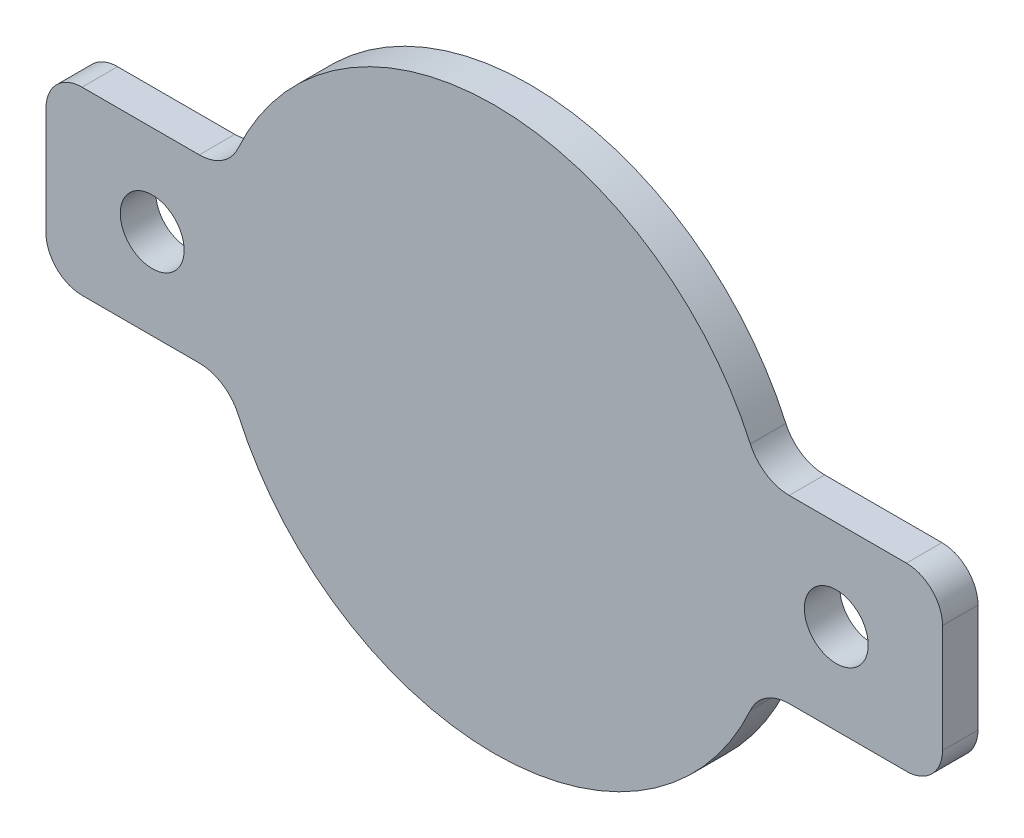
from build123d import *

# Parameters (mm, degrees)
BOSS_EXTRUDE1_DEPTH   = 2.5
FILLET1_R             = 2.54
M4_CLEARANCE_HOLE1_D  = 4.5
BOSS_EXTRUDE2_DEPTH   = 2.5
BOSS_EXTRUDE2_2_DEPTH = 2.5
FILLET2_R             = 3


with BuildPart() as part:
    # Sketch1 → Boss-Extrude1 (new body)
    with BuildSketch(Plane(origin=(0, 0, 0), x_dir=(-1, 0, 0), z_dir=(0, 0, 1))):
        with BuildLine():
            ThreePointArc((17.121950758, 4.160440607), (0.514545783, 15.590440607), (-16.092859192, 4.160440607))
            Line((-16.092859192, 4.160440607), (-31.053947254, 4.160440607))
            Line((-31.053947254, 4.160440607), (-31.053947254, -8.539559393))
            Line((-31.053947254, -8.539559393), (-16.092859192, -8.539559393))
            ThreePointArc((-16.092859192, -8.539559393), (0.514545783, -19.969559393), (17.121950758, -8.539559393))
            Line((17.121950758, -8.539559393), (32.08303882, -8.539559393))
            Line((32.08303882, -8.539559393), (32.08303882, 4.160440607))
            Line((32.08303882, 4.160440607), (17.121950758, 4.160440607))
        make_face()
    extrude(amount=BOSS_EXTRUDE1_DEPTH)

    # Fillet1
    fillet1_edges = [part.edges().sort_by_distance(p)[0] for p in [
        (16.092859192, 8.539559393, 1.25),
        (-17.121950758, 8.539559393, 1.25),
        (-17.121950758, -4.160440607, 1.25),
        (16.092859192, -4.160440607, 1.25),
        (-32.08303882, -4.160440607, 1.25),
        (-32.08303882, 8.539559393, 1.25),
        (31.053947254, 8.539559393, 1.25),
        (31.053947254, -4.160440607, 1.25),
    ]]
    fillet(fillet1_edges, radius=FILLET1_R)

    # M4 Clearance Hole1 (through all)
    with Locations(Plane.XY.offset(2.5)):
        with Locations((-24.602494789, 2.189559393), (23.573403223, 2.189559393)):
            Hole(M4_CLEARANCE_HOLE1_D / 2)


with BuildPart() as body_2:
    # Sketch4 → Boss-Extrude2 (new body)
    with BuildSketch(Plane.XY.offset(2.5)):
        with BuildLine():
            Line((17.757572321, 8.539559393), (18.218470525, 8.539559393))
            ThreePointArc((18.218470525, 8.539559393), (-0.514545783, 21.969559393), (-19.247562091, 8.539559393))
            Line((-19.247562091, 8.539559393), (-18.786663887, 8.539559393))
            ThreePointArc((-18.786663887, 8.539559393), (-17.439625469, 8.926169624), (-16.502649124, 9.968309393))
            ThreePointArc((-16.502649124, 9.968309393), (-0.514545783, 19.969559393), (15.473557558, 9.968309393))
            ThreePointArc((15.473557558, 9.968309393), (16.410533903, 8.926169624), (17.757572321, 8.539559393))
        make_face()
    extrude(amount=-BOSS_EXTRUDE2_DEPTH)


with BuildPart() as body_3:
    # Sketch4 → Boss-Extrude2 2 (new body)
    with BuildSketch(Plane.XY.offset(2.5)):
        with BuildLine():
            ThreePointArc((-19.247562091, -4.160440607), (-0.514545783, -17.590440607), (18.218470525, -4.160440607))
            Line((18.218470525, -4.160440607), (17.757572321, -4.160440607))
            ThreePointArc((17.757572321, -4.160440607), (16.410533903, -4.547050837), (15.473557558, -5.589190607))
            ThreePointArc((15.473557558, -5.589190607), (-0.514545783, -15.590440607), (-16.502649124, -5.589190607))
            ThreePointArc((-16.502649124, -5.589190607), (-17.439625469, -4.547050837), (-18.786663887, -4.160440607))
            Line((-18.786663887, -4.160440607), (-19.247562091, -4.160440607))
        make_face()
    extrude(amount=-BOSS_EXTRUDE2_2_DEPTH)


with BuildPart() as part_1:
    add(part.part)

    # Combine1: union body 2, body 3
    add(body_2.part)
    add(body_3.part)

    # Fillet2
    fillet2_edges = [part_1.edges().sort_by_distance(p)[0] for p in [
        (18.218470525, -4.160440607, 1.25),
        (18.218470525, 8.539559393, 1.25),
        (-19.247562091, -4.160440607, 1.25),
        (-19.247562091, 8.539559393, 1.25),
    ]]
    fillet(fillet2_edges, radius=FILLET2_R)


solid = part_1.part
